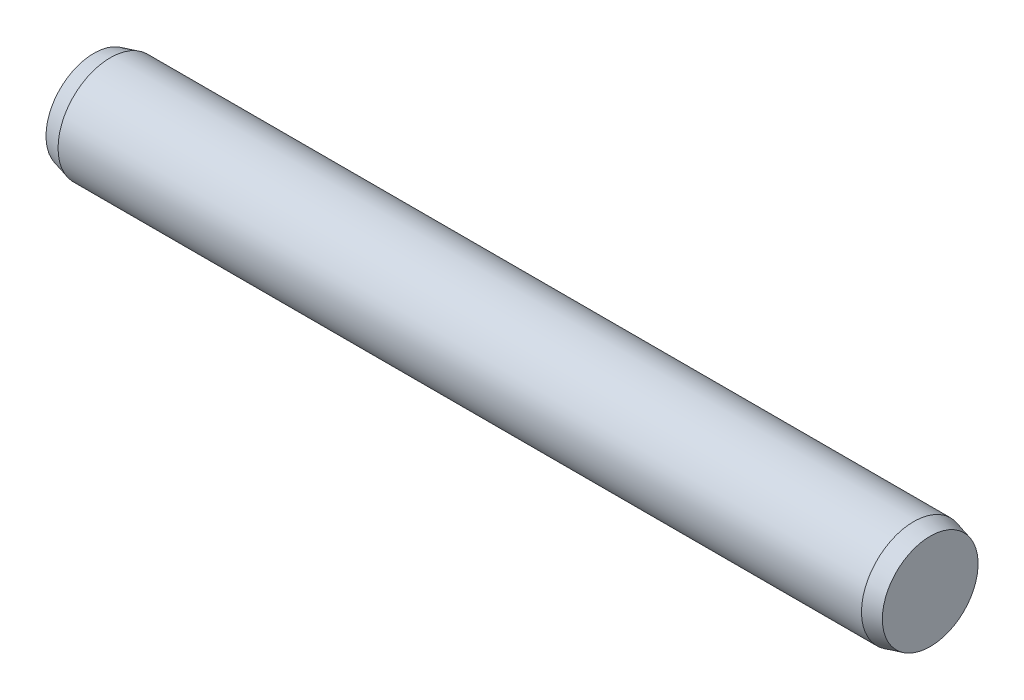
from build123d import *


with BuildPart() as part:
    # Sketch1 → Base-Revolve (revolve)
    with BuildSketch(Plane.XY, mode=Mode.PRIVATE) as base_revolve_sk:
        Polygon((0, 0), (32, 0), (32, 1.831192009), (31.37, 2), (0.63, 2), (0, 1.831192009), align=None)
    revolve(base_revolve_sk.sketch.rotate(Axis((-6.35, 0, 0), (1, 0, 0)), 90), axis=Axis((-6.35, 0, 0), (1, 0, 0)))


solid = part.part
